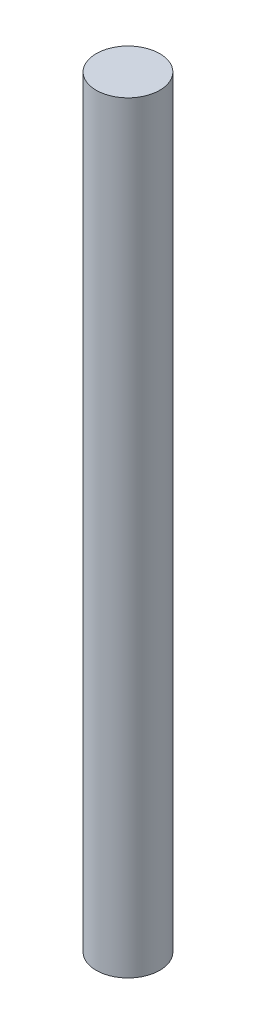
from build123d import *

# Parameters (mm, degrees)
SKETCH1_R           = 0.5
BOSS_EXTRUDE1_DEPTH = 12


with BuildPart() as part:
    # Sketch1 → Boss-Extrude1 (new body)
    with BuildSketch(Plane(origin=(0, 0, 0), x_dir=(1, 0, 0), z_dir=(0, 1, 0))):
        with Locations(Location((0, 0, 0), (0, 0, 270))):
            Circle(SKETCH1_R)
    extrude(amount=BOSS_EXTRUDE1_DEPTH)


solid = part.part
